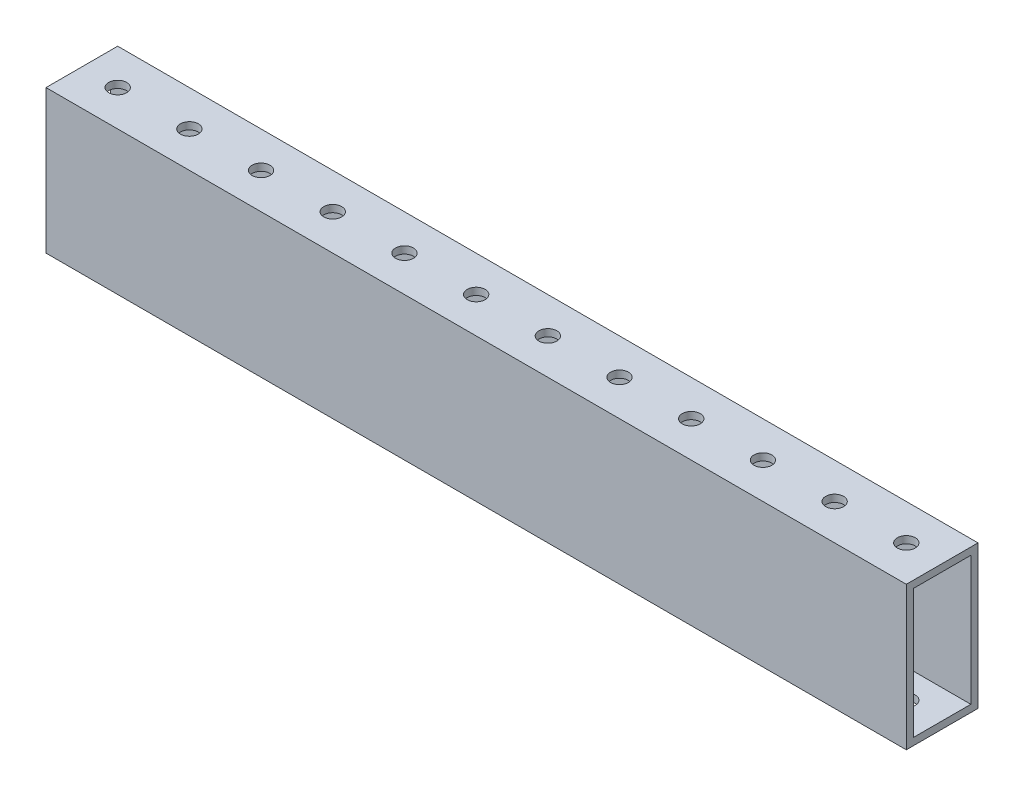
from build123d import *

# Parameters (mm, degrees)
SKETCH1_W           = 25.4
SKETCH1_H           = 50.8
SKETCH1_W_2         = 20.32
SKETCH1_H_2         = 45.72
BOSS_EXTRUDE1_DEPTH = 304.8
SKETCH2_R           = 3.175
CUT_EXTRUDE1_DEPTH  = 304.8


with BuildPart() as part:
    # Sketch1 → Boss-Extrude1 (new body)
    with BuildSketch(Plane(origin=(0, 0, 0), x_dir=(0, 0, -1), z_dir=(1, 0, 0))):
        Rectangle(SKETCH1_W, SKETCH1_H)
        Rectangle(SKETCH1_W_2, SKETCH1_H_2, mode=Mode.SUBTRACT)
    extrude(amount=BOSS_EXTRUDE1_DEPTH)

    # Sketch2 → Cut-Extrude1 (cut)
    with BuildSketch(Plane(origin=(0, 25.4, 0), x_dir=(1, 0, 0), z_dir=(0, 1, 0))):
        with Locations(Location((12.7, 0, 0), (0, 0, 270))):
            Circle(SKETCH2_R)
        with Locations(Location((38.1, 0, 0), (0, 0, 270))):
            Circle(SKETCH2_R)
        with Locations(Location((63.5, 0, 0), (0, 0, 270))):
            Circle(SKETCH2_R)
        with Locations(Location((88.9, 0, 0), (0, 0, 270))):
            Circle(SKETCH2_R)
        with Locations(Location((114.3, 0, 0), (0, 0, 270))):
            Circle(SKETCH2_R)
        with Locations(Location((139.7, 0, 0), (0, 0, 270))):
            Circle(SKETCH2_R)
        with Locations(Location((165.1, 0, 0), (0, 0, 270))):
            Circle(SKETCH2_R)
        with Locations(Location((190.5, 0, 0), (0, 0, 270))):
            Circle(SKETCH2_R)
        with Locations(Location((215.9, 0, 0), (0, 0, 270))):
            Circle(SKETCH2_R)
        with Locations(Location((241.3, 0, 0), (0, 0, 270))):
            Circle(SKETCH2_R)
        with Locations(Location((266.7, 0, 0), (0, 0, 270))):
            Circle(SKETCH2_R)
        with Locations(Location((292.1, 0, 0), (0, 0, 270))):
            Circle(SKETCH2_R)
    extrude(amount=-CUT_EXTRUDE1_DEPTH, mode=Mode.SUBTRACT)


solid = part.part
